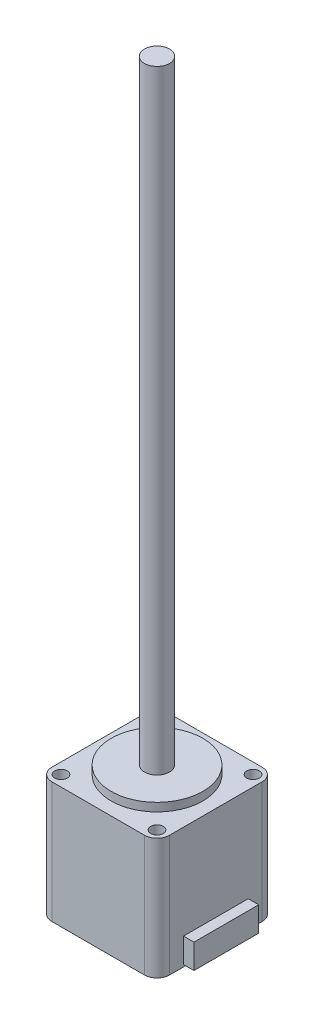
from build123d import *

# Parameters (mm, degrees)
SKETCH2_W           = 11
SKETCH2_H           = 2
SKETCH3_W           = 28.2
SKETCH3_H           = 29
BOSS_EXTRUDE1_DEPTH = 14.1
FILLET1_R           = 3
SKETCH5_W           = 15.5
SKETCH5_H           = 5.9
BOSS_EXTRUDE2_DEPTH = 2.5
SKETCH1_W           = 3
SKETCH1_H           = 147
CUT_EXTRUDE1_REACH  = 152.583
SKETCH7_R           = 1.5


with BuildPart() as part:
    # Sketch2 → Revolve2 (revolve)
    with BuildSketch(Plane(origin=(0, 0, 0), x_dir=(0, 0, -1), z_dir=(1, 0, 0)), mode=Mode.PRIVATE) as revolve2_sk:
        with Locations((-5.5, 1)):
            Rectangle(SKETCH2_W, SKETCH2_H)
    revolve(revolve2_sk.sketch.rotate(Axis((0, -54.281249734, 0), (0, 1, 0)), 180), axis=Axis((0, -54.281249734, 0), (0, 1, 0)))

    # Sketch3 → Boss-Extrude1 (add, symmetric)
    with BuildSketch(Plane(origin=(0, 0, 0), x_dir=(0, 0, -1), z_dir=(1, 0, 0))):
        with Locations((0, -14.5)):
            Rectangle(SKETCH3_W, SKETCH3_H)
    extrude(amount=BOSS_EXTRUDE1_DEPTH, both=True)

    # Fillet1
    fillet1_edges = [part.edges().sort_by_distance(p)[0] for p in [
        (-14.1, -14.5, -14.1),
        (14.1, -14.5, 14.1),
        (14.1, -14.5, -14.1),
        (-14.1, -14.5, 14.1),
    ]]
    fillet(fillet1_edges, radius=FILLET1_R)

    # Sketch5 → Boss-Extrude2 (add)
    with BuildSketch(Plane(origin=(14.1, 0, 0), x_dir=(0, 0, -1), z_dir=(1, 0, 0))):
        with Locations((0, -25.55)):
            Rectangle(SKETCH5_W, SKETCH5_H)
    extrude(amount=BOSS_EXTRUDE2_DEPTH)

    # Sketch1 → Revolve3 (revolve)
    with BuildSketch(Plane(origin=(0, 0, 0), x_dir=(0, 0, -1), z_dir=(1, 0, 0)), mode=Mode.PRIVATE) as revolve3_sk:
        with Locations((-1.5, 75.5)):
            Rectangle(SKETCH1_W, SKETCH1_H)
    revolve(revolve3_sk.sketch.rotate(Axis((0, -54.281249734, 0), (0, 1, 0)), 180), axis=Axis((0, -54.281249734, 0), (0, 1, 0)))

    # Sketch7 → Cut-Extrude1 (cut, up to next)
    with BuildSketch(Plane(origin=(0, 0, 0), x_dir=(1, 0, 0), z_dir=(0, 1, 0)), mode=Mode.PRIVATE) as cut_extrude1_sk1:
        with Locations(Location((-11.5, 11.5, 0), (0, 0, 270))):
            Circle(SKETCH7_R)
    cut_extrude1_tool1 = extrude(cut_extrude1_sk1.sketch, amount=-CUT_EXTRUDE1_REACH, mode=Mode.PRIVATE) & part.part
    # Sketch7 → Cut-Extrude1 (cut, up to next)
    with BuildSketch(Plane(origin=(0, 0, 0), x_dir=(1, 0, 0), z_dir=(0, 1, 0)), mode=Mode.PRIVATE) as cut_extrude1_sk2:
        with Locations(Location((-11.5, -11.5, 0), (0, 0, 270))):
            Circle(SKETCH7_R)
    cut_extrude1_tool2 = extrude(cut_extrude1_sk2.sketch, amount=-CUT_EXTRUDE1_REACH, mode=Mode.PRIVATE) & part.part
    # Sketch7 → Cut-Extrude1 (cut, up to next)
    with BuildSketch(Plane(origin=(0, 0, 0), x_dir=(1, 0, 0), z_dir=(0, 1, 0)), mode=Mode.PRIVATE) as cut_extrude1_sk3:
        with Locations(Location((11.5, -11.5, 0), (0, 0, 270))):
            Circle(SKETCH7_R)
    cut_extrude1_tool3 = extrude(cut_extrude1_sk3.sketch, amount=-CUT_EXTRUDE1_REACH, mode=Mode.PRIVATE) & part.part
    # Sketch7 → Cut-Extrude1 (cut, up to next)
    with BuildSketch(Plane(origin=(0, 0, 0), x_dir=(1, 0, 0), z_dir=(0, 1, 0)), mode=Mode.PRIVATE) as cut_extrude1_sk4:
        with Locations(Location((11.5, 11.5, 0), (0, 0, 270))):
            Circle(SKETCH7_R)
    cut_extrude1_tool4 = extrude(cut_extrude1_sk4.sketch, amount=-CUT_EXTRUDE1_REACH, mode=Mode.PRIVATE) & part.part
    add(cut_extrude1_tool1.solids().sort_by_distance((-11.5, 0, -11.5))[0], mode=Mode.SUBTRACT)
    add(cut_extrude1_tool2.solids().sort_by_distance((-11.5, 0, 11.5))[0], mode=Mode.SUBTRACT)
    add(cut_extrude1_tool3.solids().sort_by_distance((11.5, 0, 11.5))[0], mode=Mode.SUBTRACT)
    add(cut_extrude1_tool4.solids().sort_by_distance((11.5, 0, -11.5))[0], mode=Mode.SUBTRACT)


solid = part.part
